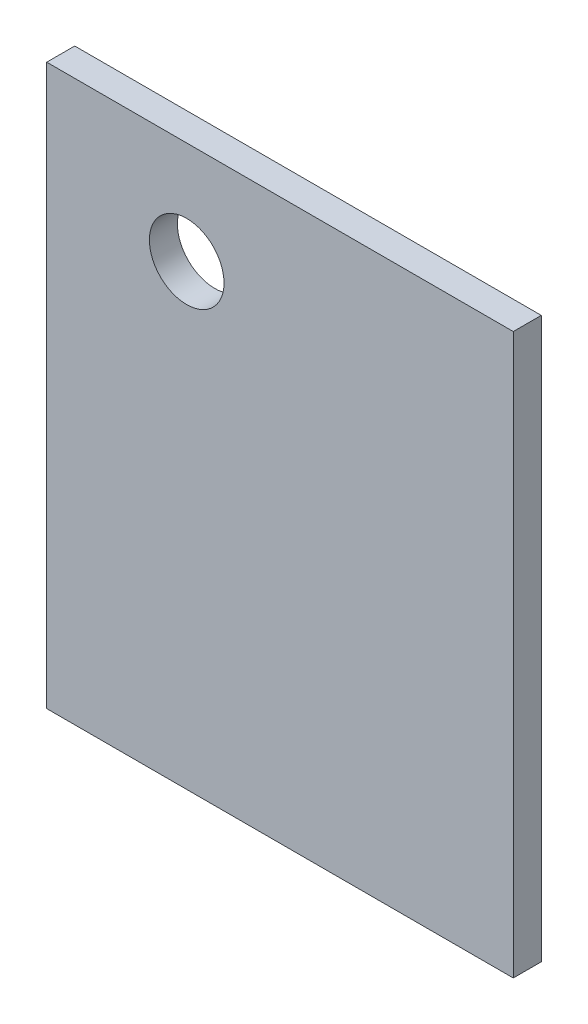
from build123d import *

# Parameters (mm, degrees)
SKETCH1_W           = 50
SKETCH1_H           = 60
SKETCH1_R           = 4
BOSS_EXTRUDE1_DEPTH = 3


with BuildPart() as part:
    # Sketch1 → Boss-Extrude1 (new body)
    with BuildSketch(Plane.XY):
        Rectangle(SKETCH1_W, SKETCH1_H)
        with Locations((-10, 19)):
            Circle(SKETCH1_R, mode=Mode.SUBTRACT)
    extrude(amount=BOSS_EXTRUDE1_DEPTH)


solid = part.part
